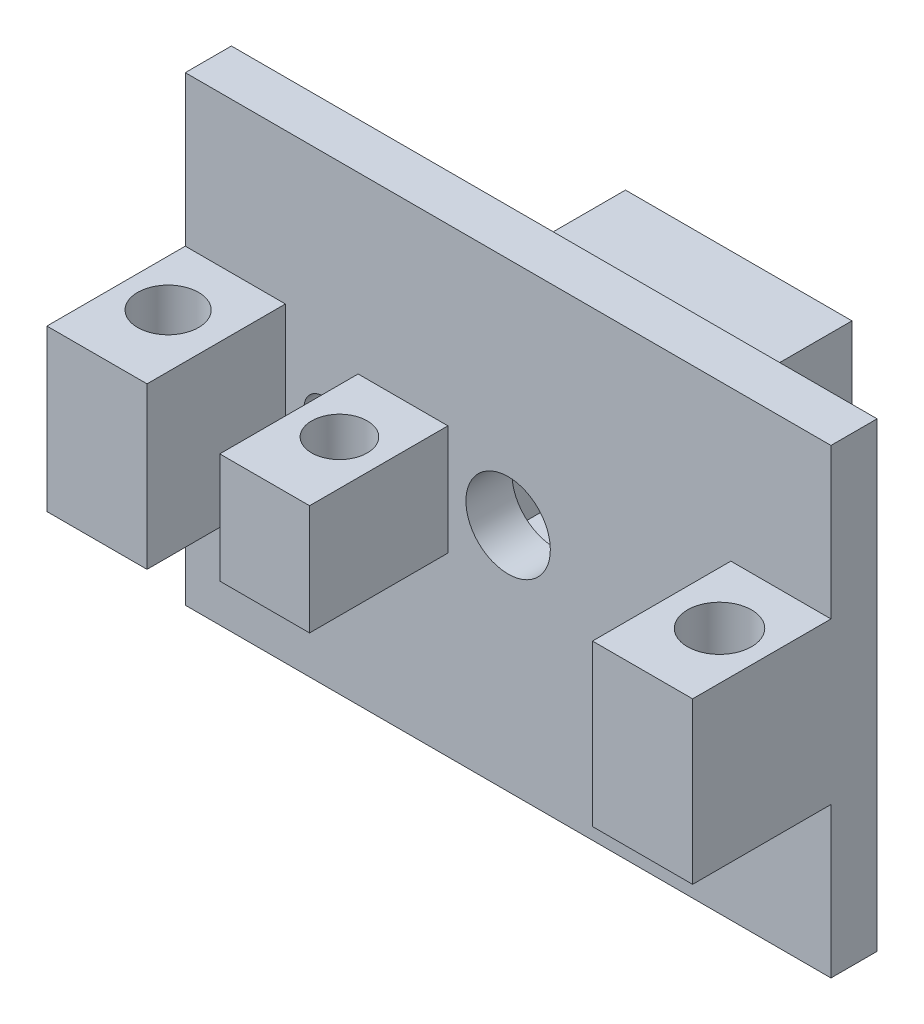
from build123d import *

# Parameters (mm, degrees)
ESQUISSE1_W             = 140
ESQUISSE1_H             = 100
ESQUISSE1_R             = 4.25
ESQUISSE1_R_2           = 9.151639609
BOSS_EXTRU_1_DEPTH      = 10
ESQUISSE2_W             = 49.107036246
ESQUISSE2_H             = 51.344503494
ESQUISSE2_W_2           = 39.107036246
ESQUISSE2_H_2           = 41.344503494
BOSS_EXTRU_2_DEPTH      = 40
ESQUISSE3_W             = 21.709616914
ESQUISSE3_H             = 34.834623488
ESQUISSE3_W_2           = 19.469502637
ESQUISSE3_H_2           = 23.889605939
BOSS_EXTRU_3_DEPTH      = 30
ESQUISSE4_R             = 6.609240876
ESQUISSE4_R_2           = 6.031853903
ESQUISSE4_R_3           = 6.937899237
ENL_V_MAT_EXTRU_1_DEPTH = 106.095641788


with BuildPart() as part:
    # Esquisse1 → Boss.-Extru.1 (new body)
    with BuildSketch(Plane.XY):
        Rectangle(ESQUISSE1_W, ESQUISSE1_H)
        with Locations((-40, 0)):
            Circle(ESQUISSE1_R, mode=Mode.SUBTRACT)
        with Locations(Location((40, 0, 0), (0, 0, 180))):
            Circle(ESQUISSE1_R, mode=Mode.SUBTRACT)
        Circle(ESQUISSE1_R_2, mode=Mode.SUBTRACT)
    extrude(amount=BOSS_EXTRU_1_DEPTH)

    # Esquisse2 → Boss.-Extru.2 (add)
    with BuildSketch(Plane(origin=(0, 0, 0), x_dir=(-1, 0, 0), z_dir=(0, 0, -1))):
        Rectangle(ESQUISSE2_W, ESQUISSE2_H)
        Rectangle(ESQUISSE2_W_2, ESQUISSE2_H_2, mode=Mode.SUBTRACT)
    extrude(amount=BOSS_EXTRU_2_DEPTH)

    # Esquisse3 → Boss.-Extru.3 (add)
    with BuildSketch(Plane.XY.offset(10)):
        with Locations((-59.145191543, 0)):
            Rectangle(ESQUISSE3_W, ESQUISSE3_H)
        with Locations((59.145191543, 0)):
            Rectangle(ESQUISSE3_W, ESQUISSE3_H)
        with Locations((-22.784580114, 0.210481109)):
            Rectangle(ESQUISSE3_W_2, ESQUISSE3_H_2)
    extrude(amount=BOSS_EXTRU_3_DEPTH)

    # Esquisse4 → Enlèv. mat.-Extru.1 (cut, through all)
    with BuildSketch(Plane(origin=(0, 17.417311744, 0), x_dir=(1, 0, 0), z_dir=(0, 1, 0))):
        with Locations(Location((-59.881875423, -23.83698556, 0), (0, 0, 270))):
            Circle(ESQUISSE4_R)
        with Locations(Location((-22.731959739, -23.83698556, 0), (0, 0, 270))):
            Circle(ESQUISSE4_R_2)
        with Locations(Location((59.671394315, -23.83698556, 0), (0, 0, 270))):
            Circle(ESQUISSE4_R_3)
    extrude(amount=-ENL_V_MAT_EXTRU_1_DEPTH, mode=Mode.SUBTRACT)


solid = part.part
